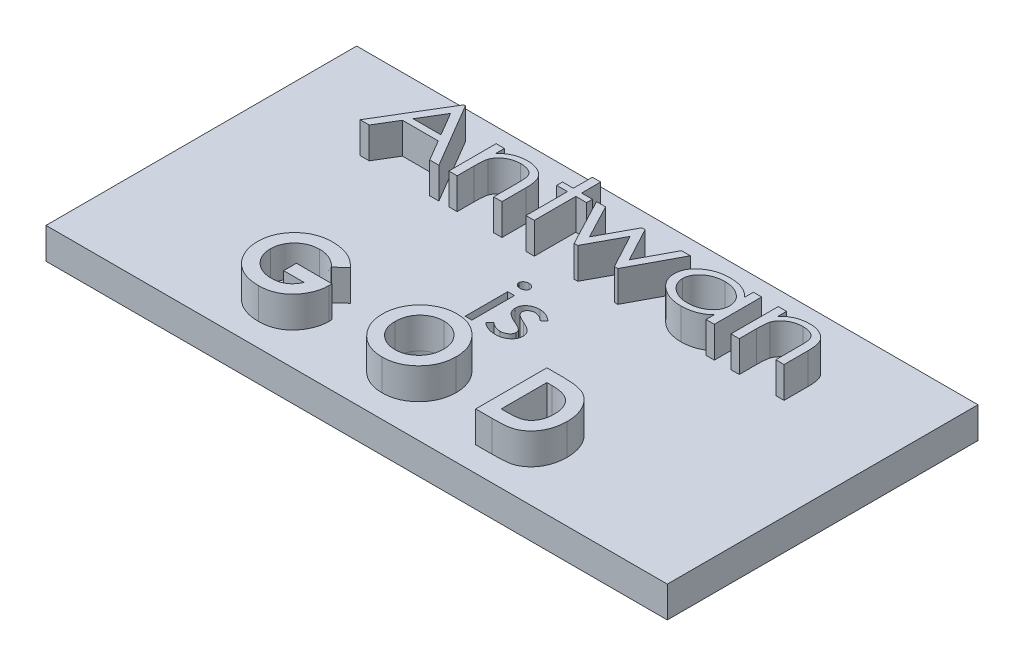
from build123d import *

# Parameters (mm, degrees)
SKETCH1_W           = 50.8
SKETCH1_H           = 25.4
BOSS_EXTRUDE1_DEPTH = 2.54
BOSS_EXTRUDE2_DEPTH = 2.54
SKETCH3_W           = 0.549519231
SKETCH3_H           = 3.480288462
CUT_EXTRUDE1_DEPTH  = 5.08
BOSS_EXTRUDE3_DEPTH = 2.54
SKETCH5_R           = 2.0033937
CUT_EXTRUDE2_DEPTH  = 5.08


with BuildPart() as part:
    # Sketch1 → Boss-Extrude1 (new body)
    with BuildSketch(Plane(origin=(0, 0, 0), x_dir=(1, 0, 0), z_dir=(0, 1, 0))):
        Rectangle(SKETCH1_W, SKETCH1_H)
    extrude(amount=BOSS_EXTRUDE1_DEPTH)

    # Sketch2 → Boss-Extrude2 (add)
    # profile 1 of 6: a face of its own
    with BuildSketch(Plane(origin=(0, 2.54, 0), x_dir=(1, 0, 0), z_dir=(0, 1, 0))):
        Polygon((-14.178952991, 10.371666667), (-11.058226496, 5.08), (-11.805547209, 5.08), (-12.806214944, 6.776047009), (-15.729775975, 6.776047009), (-16.752704327, 5.08), (-17.503205128, 5.08), (-14.314636752, 10.371666667), align=None)
        Polygon((-14.252095019, 9.228954995), (-15.403286926, 7.318782051), (-13.125283787, 7.318782051), align=None, mode=Mode.SUBTRACT)
    # profile 2 of 6: a face of its own
    with BuildSketch(Plane(origin=(0, 2.54, 0), x_dir=(1, 0, 0), z_dir=(0, 1, 0))):
        with BuildLine():
            Line((-10.244123932, 8.946987179), (-9.565705128, 8.946987179))
            Line((-9.565705128, 8.946987179), (-9.565705128, 8.249487847))
            add(Edge.make_bspline(
                [(-9.565705128, 8.249487847), (-9.501971138, 8.313083765), (-9.376701349, 8.438082172), (-9.169983485, 8.598427577), (-8.953033678, 8.731253425), (-8.725656088, 8.837011734), (-8.487670422, 8.915960139), (-8.24045632, 8.973670182), (-7.982638312, 9.008096925), (-7.807220218, 9.012560633), (-7.718073918, 9.01482906)],
                knots=[0, 0, 0, 0, 1.048340829, 2.060524298, 3.039920579, 4.006993634, 4.975678011, 5.956414776, 6.961463682, 8, 8, 8, 8], degree=3))
            add(Edge.make_bspline(
                [(-7.718073918, 9.01482906), (-7.67282343, 9.014323085), (-7.583254002, 9.013321551), (-7.450941232, 9.002188805), (-7.322167124, 8.985273817), (-7.197071809, 8.962329247), (-7.075938924, 8.931576775), (-6.959240298, 8.893229385), (-6.846425678, 8.848411678), (-6.737429989, 8.798046823), (-6.634331702, 8.740869359), (-6.537113919, 8.67966806), (-6.448145538, 8.612210908), (-6.364737159, 8.541613883), (-6.289712517, 8.464606466), (-6.220072833, 8.38420686), (-6.158812519, 8.298057232), (-6.10365039, 8.206571105), (-6.05485263, 8.106156412), (-6.014390093, 7.993675668), (-5.979206719, 7.868657229), (-5.951126379, 7.730790398), (-5.929073327, 7.580022183), (-5.913470267, 7.416222472), (-5.903934962, 7.23974738), (-5.902818998, 7.117742383), (-5.90224359, 7.054834736)],
                knots=[0, 0, 0, 0, 1.060262331, 2.098697624, 3.109423819, 4.103422854, 5.077526308, 6.035981208, 6.980163365, 7.921180839, 8.847767998, 9.741390013, 10.610897672, 11.462394881, 12.299761744, 13.127905681, 13.952896984, 14.773763409, 15.629317973, 16.56463403, 17.571315197, 18.670822078, 19.85951704, 21.14083011, 22.525768156, 24, 24, 24, 24], degree=3))
            Line((-5.90224359, 7.054834736), (-5.90224359, 5.08))
            Line((-5.90224359, 5.08), (-6.580662393, 5.08))
            Line((-6.580662393, 5.08), (-6.580662393, 6.899010417))
            add(Edge.make_bspline(
                [(-6.580662393, 6.899010417), (-6.581052408, 6.951658394), (-6.581798411, 7.052361118), (-6.582290197, 7.196539202), (-6.585207044, 7.327317526), (-6.591207305, 7.444217587), (-6.595529322, 7.547512114), (-6.603399569, 7.636875869), (-6.611105506, 7.712635908), (-6.618633966, 7.758366705), (-6.622003539, 7.778834802)],
                knots=[0, 0, 0, 0, 1.433218425, 2.741396849, 3.924848674, 4.993606899, 5.927859401, 6.738630715, 7.435438905, 8, 8, 8, 8], degree=3))
            add(Edge.make_bspline(
                [(-6.622003539, 7.778834802), (-6.628019017, 7.809748553), (-6.639802123, 7.870302348), (-6.668975964, 7.956513001), (-6.705644657, 8.036835502), (-6.748191922, 8.112480901), (-6.801391055, 8.180593399), (-6.860626137, 8.243560866), (-6.928392267, 8.300195949), (-7.003446404, 8.350792709), (-7.08572957, 8.395186349), (-7.173786927, 8.434661962), (-7.268219934, 8.467283022), (-7.368598073, 8.49359371), (-7.474716811, 8.515001335), (-7.586997924, 8.529537984), (-7.705223939, 8.537948875), (-7.785901967, 8.539262528), (-7.827256944, 8.539935897)],
                knots=[0, 0, 0, 0, 0.965271947, 1.890772867, 2.783379199, 3.672093861, 4.545808322, 5.427554647, 6.319963507, 7.248949126, 8.199687355, 9.184719788, 10.206290599, 11.260632854, 12.366059072, 13.525034421, 14.731350444, 16, 16, 16, 16], degree=3))
            add(Edge.make_bspline(
                [(-7.827256944, 8.539935897), (-7.874989088, 8.539200508), (-7.969597881, 8.537742909), (-8.109567787, 8.523710755), (-8.245417626, 8.500059621), (-8.377989315, 8.468937145), (-8.505838015, 8.425283186), (-8.63182519, 8.37660497), (-8.752369334, 8.315285207), (-8.868742413, 8.246937886), (-8.977516679, 8.171356363), (-9.078356627, 8.091273488), (-9.169540268, 8.006970836), (-9.250386929, 7.917300545), (-9.322069623, 7.824150024), (-9.382540115, 7.725333937), (-9.435217227, 7.623327262), (-9.461488382, 7.551592664), (-9.474542601, 7.515947516)],
                knots=[0, 0, 0, 0, 1.109799123, 2.199707542, 3.266922372, 4.315242432, 5.362434729, 6.406139389, 7.453460635, 8.503357528, 9.542751149, 10.53089283, 11.496046904, 12.426870173, 13.335708312, 14.22502026, 15.118006989, 16, 16, 16, 16], degree=3))
            add(Edge.make_bspline(
                [(-9.474542601, 7.515947516), (-9.48192069, 7.489879513), (-9.497944194, 7.433265829), (-9.516680919, 7.340165441), (-9.530805388, 7.232073697), (-9.5433023, 7.109751603), (-9.554045896, 6.972638103), (-9.561145289, 6.820986618), (-9.565405996, 6.654522252), (-9.56560263, 6.538603246), (-9.565705128, 6.478178753)],
                knots=[0, 0, 0, 0, 0.622153576, 1.351173928, 2.178755345, 3.125267428, 4.175407924, 5.337424846, 6.612093389, 8, 8, 8, 8], degree=3))
            Line((-9.565705128, 6.478178753), (-9.565705128, 5.08))
            Line((-9.565705128, 5.08), (-10.244123932, 5.08))
            Line((-10.244123932, 5.08), (-10.244123932, 8.946987179))
        make_face()
    # profile 3 of 6: a face of its own
    with BuildSketch(Plane(origin=(0, 2.54, 0), x_dir=(1, 0, 0), z_dir=(0, 1, 0))):
        Polygon((-3.93482906, 10.507350427), (-3.256410256, 10.507350427), (-3.256410256, 8.946987179), (-2.374465812, 8.946987179), (-2.374465812, 8.472094017), (-3.256410256, 8.472094017), (-3.256410256, 5.08), (-3.93482906, 5.08), (-3.93482906, 8.472094017), (-4.816773504, 8.472094017), (-4.816773504, 8.946987179), (-3.93482906, 8.946987179), align=None)
    # profile 4 of 6: a face of its own
    with BuildSketch(Plane(origin=(0, 2.54, 0), x_dir=(1, 0, 0), z_dir=(0, 1, 0))):
        Polygon((-2.03525641, 8.946987179), (-1.296415932, 8.946987179), (0.169604701, 6.165470085), (1.668486245, 8.946987179), (1.93349359, 8.946987179), (3.426014957, 6.165470085), (4.907936031, 8.946987179), (5.630876068, 8.946987179), (3.569118924, 5.08), (3.290331197, 5.08), (1.797809829, 7.861517094), (0.297868256, 5.08), (0.003180088, 5.08), align=None)
    # profile 5 of 6: a face of its own
    with BuildSketch(Plane(origin=(0, 2.54, 0), x_dir=(1, 0, 0), z_dir=(0, 1, 0))):
        with BuildLine():
            Line((11.465277778, 8.946987179), (11.465277778, 5.08))
            Line((11.465277778, 5.08), (10.786858974, 5.08))
            Line((10.786858974, 5.08), (10.786858974, 5.748878539))
            add(Edge.make_bspline(
                [(10.786858974, 5.748878539), (10.719211003, 5.687974022), (10.585289143, 5.567402097), (10.363765824, 5.414770407), (10.130826099, 5.286717801), (9.885421069, 5.184624725), (9.628081731, 5.107135135), (9.359375303, 5.05301268), (9.079049472, 5.017310391), (8.888105858, 5.013897118), (8.790823651, 5.01215812)],
                knots=[0, 0, 0, 0, 1.000186988, 1.98005792, 2.950451851, 3.918937695, 4.897459287, 5.901142758, 6.930671412, 8, 8, 8, 8], degree=3))
            add(Edge.make_bspline(
                [(8.790823651, 5.01215812), (8.704534502, 5.014022909), (8.534337454, 5.017701026), (8.284104676, 5.045820271), (8.043419163, 5.091266606), (7.812301613, 5.154652209), (7.591145063, 5.237824971), (7.379393662, 5.338846698), (7.176919854, 5.457962227), (6.987115799, 5.594648275), (6.813272326, 5.743584664), (6.660186738, 5.902020762), (6.530768134, 6.069262872), (6.425123433, 6.24504076), (6.342630191, 6.428630144), (6.284071225, 6.620154433), (6.247958338, 6.819557774), (6.243638016, 6.955394021), (6.241452991, 7.024093884)],
                knots=[0, 0, 0, 0, 1.149825968, 2.267921147, 3.351292848, 4.411532189, 5.457652975, 6.496092779, 7.534724766, 8.584157928, 9.609304174, 10.581842155, 11.515285724, 12.421436469, 13.308880013, 14.190720771, 15.08494796, 16, 16, 16, 16], degree=3))
            add(Edge.make_bspline(
                [(6.241452991, 7.024093884), (6.243683906, 7.091372628), (6.248106088, 7.224734437), (6.283767914, 7.420866391), (6.344080843, 7.609295978), (6.426991174, 7.790343042), (6.534317736, 7.963328737), (6.665180838, 8.12826682), (6.818272535, 8.287023633), (6.99460448, 8.434072198), (7.185815511, 8.570444589), (7.389859042, 8.688829654), (7.602543813, 8.790617555), (7.825768778, 8.871924675), (8.057744275, 8.936957917), (8.299965183, 8.982483702), (8.551370323, 9.008943824), (8.722212665, 9.012848871), (8.808844151, 9.01482906)],
                knots=[0, 0, 0, 0, 0.897261844, 1.778577538, 2.649325713, 3.531133061, 4.428679736, 5.358639195, 6.335549813, 7.365975323, 8.417697389, 9.465640286, 10.50951357, 11.559596491, 12.631383867, 13.72061521, 14.844159534, 16, 16, 16, 16], degree=3))
            add(Edge.make_bspline(
                [(8.808844151, 9.01482906), (8.908585517, 9.012659388), (9.103759874, 9.008413765), (9.38919363, 8.973153473), (9.659691826, 8.913340005), (9.874826106, 8.845462921), (10.039057278, 8.778609573), (10.15779165, 8.721498197), (10.27225735, 8.65662951), (10.382780035, 8.585151073), (10.490265882, 8.508079332), (10.593181309, 8.422579588), (10.692915266, 8.330842868), (10.755436284, 8.264706893), (10.786858974, 8.231467348)],
                knots=[0, 0, 0, 0, 1.636409053, 3.202132658, 4.710311817, 6.177333486, 6.897697258, 7.618667534, 8.337886887, 9.05523388, 9.777834522, 10.506897114, 11.24957541, 12, 12, 12, 12], degree=3))
            Line((10.786858974, 8.231467348), (10.786858974, 8.946987179))
            Line((10.786858974, 8.946987179), (11.465277778, 8.946987179))
        make_face()
        with BuildLine():
            add(Edge.make_bspline(
                [(8.855485443, 8.539935897), (8.769843397, 8.537469194), (8.600921553, 8.532603825), (8.352429492, 8.494650061), (8.114007769, 8.432058329), (7.887839889, 8.345536724), (7.677450196, 8.237296277), (7.48873982, 8.105882711), (7.32107388, 7.955356721), (7.201691574, 7.812873732), (7.12000029, 7.69169862), (7.066492207, 7.599655402), (7.020157239, 7.506651321), (6.984904613, 7.410995798), (6.95574604, 7.314814181), (6.934100072, 7.217486314), (6.922660676, 7.118359312), (6.920802863, 7.052033701), (6.919871795, 7.018793737)],
                knots=[0, 0, 0, 0, 1.507851667, 2.974112515, 4.41564081, 5.841814224, 7.23074732, 8.57209151, 9.880684575, 11.188226603, 11.833756132, 12.452826221, 13.062345153, 13.661062237, 14.245806186, 14.831708012, 15.414494903, 16, 16, 16, 16], degree=3))
            add(Edge.make_bspline(
                [(6.919871795, 7.018793737), (6.92068002, 6.985890221), (6.922302418, 6.919841055), (6.935686678, 6.821703324), (6.95577955, 6.724169443), (6.984221853, 6.627949624), (7.022088374, 6.532862095), (7.067173804, 6.438615678), (7.122377167, 6.346263992), (7.20336491, 6.22311007), (7.324815933, 6.080289526), (7.492500561, 5.927316068), (7.683040759, 5.795143852), (7.893841179, 5.684957323), (8.119310081, 5.595787038), (8.356455169, 5.533972931), (8.601143654, 5.494092787), (8.767347398, 5.489413392), (8.851245326, 5.487051282)],
                knots=[0, 0, 0, 0, 0.57949018, 1.163244804, 1.741965386, 2.332879268, 2.928236174, 3.543567576, 4.171368968, 4.822294746, 6.139064333, 7.461091678, 8.81157044, 10.212281651, 11.64345589, 13.073451711, 14.522708737, 16, 16, 16, 16], degree=3))
            add(Edge.make_bspline(
                [(8.851245326, 5.487051282), (8.93618116, 5.489532951), (9.104396624, 5.494447896), (9.353168, 5.532674469), (9.595051184, 5.595438606), (9.790034976, 5.66835625), (9.938762223, 5.738784021), (10.044894592, 5.795162219), (10.144117122, 5.856296875), (10.236602933, 5.92208723), (10.32220143, 5.992360895), (10.400114483, 6.067827383), (10.473162535, 6.146439041), (10.538435244, 6.229971184), (10.596922416, 6.317098113), (10.648238579, 6.407177309), (10.690353529, 6.50078935), (10.725443468, 6.596425001), (10.753587586, 6.694423366), (10.772187388, 6.795629835), (10.784250001, 6.899427126), (10.785985054, 6.969645422), (10.786858974, 7.005013355)],
                knots=[0, 0, 0, 0, 1.862528734, 3.688739127, 5.506640726, 7.336400479, 8.244805844, 9.115182216, 9.971292008, 10.799328464, 11.603178334, 12.3980472, 13.176998374, 13.955370903, 14.720667152, 15.477279131, 16.22651052, 16.969501729, 17.710509303, 18.459941124, 19.224294792, 20, 20, 20, 20], degree=3))
            add(Edge.make_bspline(
                [(10.786858974, 7.005013355), (10.785388784, 7.05849017), (10.782487998, 7.164003581), (10.754639341, 7.31865194), (10.711802508, 7.467057593), (10.649217011, 7.608028498), (10.570152182, 7.742348585), (10.474276107, 7.870434101), (10.359484212, 7.990628151), (10.229109344, 8.10256867), (10.086424461, 8.204892554), (9.934803453, 8.295700754), (9.773970574, 8.370822999), (9.605672806, 8.432084748), (9.429835519, 8.48198643), (9.24509041, 8.514410927), (9.052860246, 8.537076023), (8.921983414, 8.538972371), (8.855485443, 8.539935897)],
                knots=[0, 0, 0, 0, 0.934434866, 1.843703859, 2.739261944, 3.630245698, 4.533235222, 5.460181769, 6.421866164, 7.43398917, 8.461260833, 9.48927571, 10.520406241, 11.560497361, 12.619021795, 13.71231236, 14.837635478, 16, 16, 16, 16], degree=3))
        make_face(mode=Mode.SUBTRACT)
    # profile 6 of 6: a face of its own
    with BuildSketch(Plane(origin=(0, 2.54, 0), x_dir=(1, 0, 0), z_dir=(0, 1, 0))):
        with BuildLine():
            Line((12.822115385, 8.946987179), (13.500534188, 8.946987179))
            Line((13.500534188, 8.946987179), (13.500534188, 8.249487847))
            add(Edge.make_bspline(
                [(13.500534188, 8.249487847), (13.564268178, 8.313083765), (13.689537967, 8.438082172), (13.896255832, 8.598427577), (14.113205639, 8.731253425), (14.340583228, 8.837011734), (14.578568894, 8.915960139), (14.825782996, 8.973670182), (15.083601004, 9.008096925), (15.259019098, 9.012560633), (15.348165398, 9.01482906)],
                knots=[0, 0, 0, 0, 1.048340829, 2.060524298, 3.039920579, 4.006993634, 4.975678011, 5.956414776, 6.961463682, 8, 8, 8, 8], degree=3))
            add(Edge.make_bspline(
                [(15.348165398, 9.01482906), (15.393415886, 9.014323085), (15.482985314, 9.013321551), (15.615298084, 9.002188805), (15.744072193, 8.985273817), (15.869167507, 8.962329247), (15.990300392, 8.931576775), (16.106999018, 8.893229385), (16.219813638, 8.848411678), (16.328809328, 8.798046823), (16.431907614, 8.740869359), (16.529125397, 8.67966806), (16.618093779, 8.612210908), (16.701502158, 8.541613883), (16.7765268, 8.464606466), (16.846166483, 8.38420686), (16.907426797, 8.298057232), (16.962588926, 8.206571105), (17.011386686, 8.106156412), (17.051849223, 7.993675668), (17.087032598, 7.868657229), (17.115112937, 7.730790398), (17.137165989, 7.580022183), (17.152769049, 7.416222472), (17.162304354, 7.23974738), (17.163420318, 7.117742383), (17.163995726, 7.054834736)],
                knots=[0, 0, 0, 0, 1.060262331, 2.098697624, 3.109423819, 4.103422854, 5.077526308, 6.035981208, 6.980163365, 7.921180839, 8.847767998, 9.741390013, 10.610897672, 11.462394881, 12.299761744, 13.127905681, 13.952896984, 14.773763409, 15.629317973, 16.56463403, 17.571315197, 18.670822078, 19.85951704, 21.14083011, 22.525768156, 24, 24, 24, 24], degree=3))
            Line((17.163995726, 7.054834736), (17.163995726, 5.08))
            Line((17.163995726, 5.08), (16.485576923, 5.08))
            Line((16.485576923, 5.08), (16.485576923, 6.899010417))
            add(Edge.make_bspline(
                [(16.485576923, 6.899010417), (16.485186908, 6.951658394), (16.484440906, 7.052361118), (16.483949119, 7.196539202), (16.481032272, 7.327317526), (16.475032011, 7.444217587), (16.470709994, 7.547512114), (16.462839747, 7.636875869), (16.45513381, 7.712635908), (16.44760535, 7.758366705), (16.444235777, 7.778834802)],
                knots=[0, 0, 0, 0, 1.433218425, 2.741396849, 3.924848674, 4.993606899, 5.927859401, 6.738630715, 7.435438905, 8, 8, 8, 8], degree=3))
            add(Edge.make_bspline(
                [(16.444235777, 7.778834802), (16.4382203, 7.809748553), (16.426437193, 7.870302348), (16.397263353, 7.956513001), (16.360594659, 8.036835502), (16.318047394, 8.112480901), (16.264848261, 8.180593399), (16.20561318, 8.243560866), (16.137847049, 8.300195949), (16.062792913, 8.350792709), (15.980509746, 8.395186349), (15.89245239, 8.434661962), (15.798019382, 8.467283022), (15.697641243, 8.49359371), (15.591522506, 8.515001335), (15.479241392, 8.529537984), (15.361015377, 8.537948875), (15.280337349, 8.539262528), (15.238982372, 8.539935897)],
                knots=[0, 0, 0, 0, 0.965271947, 1.890772867, 2.783379199, 3.672093861, 4.545808322, 5.427554647, 6.319963507, 7.248949126, 8.199687355, 9.184719788, 10.206290599, 11.260632854, 12.366059072, 13.525034421, 14.731350444, 16, 16, 16, 16], degree=3))
            add(Edge.make_bspline(
                [(15.238982372, 8.539935897), (15.191250229, 8.539200508), (15.096641436, 8.537742909), (14.956671529, 8.523710755), (14.820821691, 8.500059621), (14.688250001, 8.468937145), (14.560401301, 8.425283186), (14.434414126, 8.37660497), (14.313869983, 8.315285207), (14.197496903, 8.246937886), (14.088722637, 8.171356363), (13.987882689, 8.091273488), (13.896699048, 8.006970836), (13.815852387, 7.917300545), (13.744169693, 7.824150024), (13.683699202, 7.725333937), (13.63102209, 7.623327262), (13.604750934, 7.551592664), (13.591696715, 7.515947516)],
                knots=[0, 0, 0, 0, 1.109799123, 2.199707542, 3.266922372, 4.315242432, 5.362434729, 6.406139389, 7.453460635, 8.503357528, 9.542751149, 10.53089283, 11.496046904, 12.426870173, 13.335708312, 14.22502026, 15.118006989, 16, 16, 16, 16], degree=3))
            add(Edge.make_bspline(
                [(13.591696715, 7.515947516), (13.584318627, 7.489879513), (13.568295123, 7.433265829), (13.549558398, 7.340165441), (13.535433928, 7.232073697), (13.522937016, 7.109751603), (13.51219342, 6.972638103), (13.505094027, 6.820986618), (13.50083332, 6.654522252), (13.500636686, 6.538603246), (13.500534188, 6.478178753)],
                knots=[0, 0, 0, 0, 0.622153576, 1.351173928, 2.178755345, 3.125267428, 4.175407924, 5.337424846, 6.612093389, 8, 8, 8, 8], degree=3))
            Line((13.500534188, 6.478178753), (13.500534188, 5.08))
            Line((13.500534188, 5.08), (12.822115385, 5.08))
            Line((12.822115385, 5.08), (12.822115385, 8.946987179))
        make_face()
    extrude(amount=BOSS_EXTRUDE2_DEPTH)

    # Sketch3 → Cut-Extrude1 (cut)
    with BuildSketch(Plane(origin=(0, 2.54, 0), x_dir=(1, 0, 0), z_dir=(0, 1, 0))):
        with BuildLine():
            add(Edge.make_bspline(
                [(-1.558879207, 2.94754881), (-1.528247703, 2.946310031), (-1.468515684, 2.943894387), (-1.382299681, 2.923756607), (-1.303979801, 2.888439832), (-1.233871058, 2.842234311), (-1.174442973, 2.786684937), (-1.130346868, 2.723213155), (-1.103985364, 2.6527884), (-1.100701107, 2.603995749), (-1.099038462, 2.579294604)],
                knots=[0, 0, 0, 0, 1.126292746, 2.196292449, 3.23347918, 4.271985151, 5.273442343, 6.208143861, 7.092877767, 8, 8, 8, 8], degree=3))
            add(Edge.make_bspline(
                [(-1.099038462, 2.579294604), (-1.100736009, 2.555234216), (-1.104111656, 2.507389105), (-1.13034945, 2.438160173), (-1.174770892, 2.375640395), (-1.233832074, 2.320142144), (-1.303990376, 2.273973309), (-1.382296768, 2.23864655), (-1.468516467, 2.218511506), (-1.528247969, 2.216095479), (-1.558879207, 2.214856503)],
                knots=[0, 0, 0, 0, 0.888755228, 1.767327854, 2.697484928, 3.7044632, 4.748694502, 5.79159929, 6.86749795, 8, 8, 8, 8], degree=3))
            add(Edge.make_bspline(
                [(-1.558879207, 2.214856503), (-1.58887797, 2.216105702), (-1.647669539, 2.218553882), (-1.732864778, 2.238833518), (-1.810930524, 2.273943983), (-1.880985059, 2.320199891), (-1.940264998, 2.375329123), (-1.983448297, 2.438474905), (-2.009882557, 2.50735334), (-2.013223667, 2.555222249), (-2.014903846, 2.579294604)],
                knots=[0, 0, 0, 0, 1.114826149, 2.184835993, 3.233187219, 4.282871886, 5.295108974, 6.223442501, 7.10660336, 8, 8, 8, 8], degree=3))
            add(Edge.make_bspline(
                [(-2.014903846, 2.579294604), (-2.013259193, 2.604007957), (-2.010010478, 2.652824724), (-1.983446457, 2.722900197), (-1.940593644, 2.786991753), (-1.880946479, 2.842177625), (-1.810940993, 2.888468873), (-1.732861927, 2.923569742), (-1.647670293, 2.943851974), (-1.588878225, 2.946299795), (-1.558879207, 2.94754881)],
                knots=[0, 0, 0, 0, 0.911825585, 1.801146763, 2.734119375, 3.740769039, 4.784659576, 5.827224033, 6.891327554, 8, 8, 8, 8], degree=3))
        make_face()
        with Locations((-1.556971154, -0.257980036)):
            Rectangle(SKETCH3_W, SKETCH3_H)
        with BuildLine():
            Line((1.892788462, 1.048082164), (1.549338942, 0.749471887))
            add(Edge.make_bspline(
                [(1.549338942, 0.749471887), (1.516684572, 0.778595656), (1.453164936, 0.835247528), (1.353677107, 0.909483407), (1.255338997, 0.972943899), (1.157555404, 1.025133276), (1.060076125, 1.065424997), (0.962963574, 1.094417507), (0.866287974, 1.112395087), (0.801773123, 1.114686139), (0.769899339, 1.115818041)],
                knots=[0, 0, 0, 0, 1.191143459, 2.317025185, 3.376493024, 4.376036135, 5.331378458, 6.243873407, 7.132379622, 8, 8, 8, 8], degree=3))
            add(Edge.make_bspline(
                [(0.769899339, 1.115818041), (0.73092821, 1.114364615), (0.654870025, 1.11152803), (0.54552064, 1.083576895), (0.444389604, 1.039526722), (0.355173273, 0.9778304), (0.280331838, 0.905722286), (0.22354251, 0.826177924), (0.188914833, 0.738792173), (0.18508941, 0.677896526), (0.183173077, 0.647391058)],
                knots=[0, 0, 0, 0, 1.126613547, 2.19876053, 3.246056558, 4.306150977, 5.322123348, 6.241830403, 7.119250902, 8, 8, 8, 8], degree=3))
            add(Edge.make_bspline(
                [(0.183173077, 0.647391058), (0.185070095, 0.619799434), (0.188893514, 0.564188835), (0.219005785, 0.482715753), (0.266384032, 0.403560759), (0.309450811, 0.356335918), (0.332001202, 0.331608306)],
                knots=[0, 0, 0, 0, 0.923464895, 1.861232764, 2.88011042, 4, 4, 4, 4], degree=3))
            add(Edge.make_bspline(
                [(0.332001202, 0.331608306), (0.346071142, 0.318285844), (0.376135261, 0.28981891), (0.429977778, 0.250151649), (0.49243284, 0.206935503), (0.566374459, 0.163845462), (0.649274953, 0.117494056), (0.743507563, 0.071457914), (0.846962268, 0.021292315), (0.920505146, -0.010534454), (0.958796575, -0.027105637)],
                knots=[0, 0, 0, 0, 0.640357809, 1.368292506, 2.208553831, 3.152034543, 4.197222919, 5.349749855, 6.620099349, 8, 8, 8, 8], degree=3))
            add(Edge.make_bspline(
                [(0.958796575, -0.027105637), (1.005333604, -0.047856128), (1.09512793, -0.087894704), (1.22333098, -0.149684271), (1.33955385, -0.211865215), (1.444926632, -0.272230661), (1.537567527, -0.333630955), (1.619255859, -0.393533117), (1.689421723, -0.453250036), (1.729651786, -0.49552074), (1.748730469, -0.515567175)],
                knots=[0, 0, 0, 0, 1.307861289, 2.523550029, 3.651918164, 4.690727197, 5.639318476, 6.502942042, 7.290036046, 8, 8, 8, 8], degree=3))
            add(Edge.make_bspline(
                [(1.748730469, -0.515567175), (1.780251111, -0.555545069), (1.841888435, -0.633720201), (1.905594389, -0.767415756), (1.947529445, -0.907674495), (1.951727401, -1.004678933), (1.953846154, -1.053638089)],
                knots=[0, 0, 0, 0, 1.035861265, 2.025584197, 3.003491674, 4, 4, 4, 4], degree=3))
            add(Edge.make_bspline(
                [(1.953846154, -1.053638089), (1.952811777, -1.088067608), (1.950768081, -1.156092591), (1.932512196, -1.255786226), (1.905764981, -1.352114963), (1.864131316, -1.443227483), (1.814222783, -1.531883487), (1.750009711, -1.614687988), (1.676222153, -1.694493544), (1.591750692, -1.769128421), (1.499135115, -1.837088686), (1.400140075, -1.897171004), (1.29485448, -1.946206073), (1.184284494, -1.987779483), (1.068088665, -2.020027947), (0.945878936, -2.043025299), (0.818212659, -2.056263888), (0.731132492, -2.058198997), (0.686899038, -2.059181959)],
                knots=[0, 0, 0, 0, 0.917983003, 1.813727822, 2.697369886, 3.578890162, 4.479966245, 5.406733975, 6.367575675, 7.377535281, 8.409575044, 9.429858185, 10.462456109, 11.504427907, 12.579268083, 13.676162811, 14.819577984, 16, 16, 16, 16], degree=3))
            add(Edge.make_bspline(
                [(0.686899038, -2.059181959), (0.627028679, -2.057836243), (0.508392135, -2.05516963), (0.332817189, -2.030121311), (0.161368337, -1.991097561), (-0.00452181, -1.937218946), (-0.161416185, -1.869345552), (-0.305097238, -1.787424269), (-0.436425753, -1.695975664), (-0.512199993, -1.623558671), (-0.549519231, -1.587892896)],
                knots=[0, 0, 0, 0, 1.058510203, 2.097498541, 3.130500184, 4.165827308, 5.17851881, 6.1483704, 7.088062041, 8, 8, 8, 8], degree=3))
            Line((-0.549519231, -1.587892896), (-0.213701923, -1.265431959))
            add(Edge.make_bspline(
                [(-0.213701923, -1.265431959), (-0.180113156, -1.294596809), (-0.114520225, -1.351550612), (-0.010963302, -1.425955), (0.093554656, -1.48999947), (0.20046457, -1.541321499), (0.308668599, -1.581836561), (0.418262254, -1.610634035), (0.529530952, -1.628511697), (0.604469137, -1.630686955), (0.642059796, -1.631778113)],
                knots=[0, 0, 0, 0, 1.119911591, 2.186989617, 3.207633793, 4.203557822, 5.169161927, 6.113367086, 7.053623003, 8, 8, 8, 8], degree=3))
            add(Edge.make_bspline(
                [(0.642059796, -1.631778113), (0.693124209, -1.629916869), (0.792469177, -1.62629585), (0.935063185, -1.593740225), (1.066576085, -1.542305122), (1.164347692, -1.480425975), (1.233834913, -1.423695616), (1.279728368, -1.379440308), (1.317849487, -1.332498322), (1.349604008, -1.284071282), (1.373816383, -1.233647894), (1.391238874, -1.181445226), (1.401897869, -1.127208623), (1.403516839, -1.090255059), (1.404326923, -1.071764591)],
                knots=[0, 0, 0, 0, 1.758912634, 3.42193528, 5.016576944, 6.608085231, 7.387459445, 8.108722022, 8.802442668, 9.468656318, 10.10144287, 10.725713422, 11.362384753, 12, 12, 12, 12], degree=3))
            add(Edge.make_bspline(
                [(1.404326923, -1.071764591), (1.402470422, -1.041327544), (1.398776234, -0.980761885), (1.369476903, -0.893424476), (1.322968656, -0.810885778), (1.279168735, -0.764052491), (1.256452825, -0.739763389)],
                knots=[0, 0, 0, 0, 0.977076222, 1.944251207, 2.933828981, 4, 4, 4, 4], degree=3))
            add(Edge.make_bspline(
                [(1.256452825, -0.739763389), (1.242304743, -0.727478435), (1.211484814, -0.700717111), (1.157222485, -0.661564319), (1.091535865, -0.619980741), (1.0138716, -0.57600117), (0.92442239, -0.530863408), (0.823561466, -0.48288513), (0.711158619, -0.432584701), (0.631936292, -0.398735674), (0.590542368, -0.381049447)],
                knots=[0, 0, 0, 0, 0.59191485, 1.289416773, 2.111843539, 3.047985872, 4.108703244, 5.277464275, 6.577466189, 8, 8, 8, 8], degree=3))
            add(Edge.make_bspline(
                [(0.590542368, -0.381049447), (0.545870814, -0.361341553), (0.459687162, -0.323319633), (0.337268904, -0.26295514), (0.225932888, -0.203067829), (0.125233412, -0.144235515), (0.036122189, -0.084861495), (-0.042294091, -0.026061721), (-0.109653635, 0.032674699), (-0.147887999, 0.074324933), (-0.166000601, 0.094055721)],
                knots=[0, 0, 0, 0, 1.302050987, 2.512012704, 3.639023741, 4.673208883, 5.621170565, 6.493044743, 7.286116506, 8, 8, 8, 8], degree=3))
            add(Edge.make_bspline(
                [(-0.166000601, 0.094055721), (-0.196979948, 0.13336118), (-0.257914602, 0.210672833), (-0.318693276, 0.344080118), (-0.360074608, 0.48399576), (-0.364232409, 0.580936031), (-0.366346154, 0.630218582)],
                knots=[0, 0, 0, 0, 1.024208753, 2.014561685, 2.990641718, 4, 4, 4, 4], degree=3))
            add(Edge.make_bspline(
                [(-0.366346154, 0.630218582), (-0.365561633, 0.662405034), (-0.364022068, 0.725568606), (-0.347950848, 0.818004972), (-0.323145611, 0.906287711), (-0.288997305, 0.990894609), (-0.243280181, 1.070469923), (-0.188607087, 1.146531109), (-0.123452288, 1.218016808), (-0.048962491, 1.284340899), (0.032344853, 1.345388789), (0.120677626, 1.39762438), (0.21375875, 1.442882333), (0.312055626, 1.480068551), (0.415525107, 1.508792417), (0.52412259, 1.528425663), (0.637926748, 1.541433451), (0.715800212, 1.542617109), (0.755588942, 1.543221887)],
                knots=[0, 0, 0, 0, 0.956207867, 1.876488459, 2.780496963, 3.679546525, 4.581475594, 5.502630193, 6.459912792, 7.450926542, 8.464598021, 9.478137181, 10.497350532, 11.538779896, 12.598676211, 13.685479207, 14.817416878, 16, 16, 16, 16], degree=3))
            add(Edge.make_bspline(
                [(0.755588942, 1.543221887), (0.802736429, 1.541697226), (0.897891688, 1.538620084), (1.040378972, 1.515110636), (1.182649691, 1.475161665), (1.325114541, 1.420588734), (1.46781302, 1.35010006), (1.610819661, 1.265139653), (1.75402243, 1.164292675), (1.845633225, 1.087572622), (1.892788462, 1.048082164)],
                knots=[0, 0, 0, 0, 0.892727674, 1.80174466, 2.726744544, 3.687621175, 4.686992407, 5.737527298, 6.835427255, 8, 8, 8, 8], degree=3))
        make_face()
    extrude(amount=-CUT_EXTRUDE1_DEPTH, mode=Mode.SUBTRACT)

    # Sketch4 → Boss-Extrude3 (add)
    # profile 1 of 3: a face of its own
    with BuildSketch(Plane(origin=(0, 2.54, 0), x_dir=(1, 0, 0), z_dir=(0, 1, 0))):
        with BuildLine():
            Line((-7.441385049, -5.772996327), (-8.231954961, -6.529751302))
            add(Edge.make_bspline(
                [(-8.231954961, -6.529751302), (-8.294545761, -6.467085508), (-8.417359242, -6.344124874), (-8.618205329, -6.184083158), (-8.826220919, -6.048016061), (-9.042090676, -5.936132176), (-9.266115308, -5.849345308), (-9.497852718, -5.787263884), (-9.737679913, -5.750442339), (-9.900032219, -5.745287449), (-9.982169471, -5.742679487)],
                knots=[0, 0, 0, 0, 1.075575784, 2.110457258, 3.113929901, 4.09197124, 5.059417775, 6.02750972, 7.002078037, 8, 8, 8, 8], degree=3))
            add(Edge.make_bspline(
                [(-9.982169471, -5.742679487), (-10.053379958, -5.744506874), (-10.19320799, -5.748095108), (-10.398671817, -5.775343914), (-10.59500509, -5.820861818), (-10.783135367, -5.883919273), (-10.961914049, -5.965976953), (-11.132377012, -6.065768392), (-11.293475227, -6.184057005), (-11.443940159, -6.318600449), (-11.580938965, -6.465494726), (-11.700546156, -6.622723544), (-11.802425787, -6.787356293), (-11.886293502, -6.960235258), (-11.950107712, -7.141095103), (-11.995662708, -7.329804534), (-12.024578802, -7.525815135), (-12.027992929, -7.659535597), (-12.029722222, -7.727266493)],
                knots=[0, 0, 0, 0, 1.075001177, 2.110859044, 3.123021556, 4.114053297, 5.101481495, 6.087880186, 7.091499647, 8.114004866, 9.131394192, 10.11971144, 11.092043119, 12.050101265, 13.015322563, 13.981809771, 14.977764287, 16, 16, 16, 16], degree=3))
            add(Edge.make_bspline(
                [(-12.029722222, -7.727266493), (-12.02810922, -7.797341646), (-12.024931386, -7.93539929), (-11.994404692, -8.138004818), (-11.947373065, -8.332925936), (-11.878531303, -8.518716374), (-11.793807943, -8.697921201), (-11.686364763, -8.867069051), (-11.561075263, -9.028742995), (-11.418163319, -9.180128198), (-11.26271203, -9.319668922), (-11.094353225, -9.440040343), (-10.918209414, -9.543894896), (-10.731437625, -9.626144345), (-10.537279664, -9.692181642), (-10.333766213, -9.738743603), (-10.121355534, -9.767309205), (-9.976429643, -9.770744006), (-9.902879274, -9.772487179)],
                knots=[0, 0, 0, 0, 1.022067601, 2.013613092, 2.983553406, 3.943623673, 4.90013463, 5.87121881, 6.861774014, 7.881098904, 8.905697761, 9.905387765, 10.89678721, 11.884561068, 12.87834324, 13.885584958, 14.926927371, 16, 16, 16, 16], degree=3))
            add(Edge.make_bspline(
                [(-9.902879274, -9.772487179), (-9.855037482, -9.772055511), (-9.7611134, -9.771208051), (-9.623342778, -9.757451379), (-9.491391613, -9.737784619), (-9.364748895, -9.711748163), (-9.244693375, -9.674901906), (-9.129562803, -9.631814746), (-9.020031742, -9.580963306), (-8.916694059, -9.520593117), (-8.818011788, -9.452925513), (-8.724908616, -9.375499386), (-8.635751402, -9.290060408), (-8.551581937, -9.195564822), (-8.473824815, -9.091167726), (-8.399988894, -8.978787555), (-8.330919583, -8.857309004), (-8.29010835, -8.771527005), (-8.269267995, -8.727722222)],
                knots=[0, 0, 0, 0, 1.109579412, 2.178351274, 3.208885622, 4.204702371, 5.174744997, 6.119429583, 7.05542196, 7.97267548, 8.893247984, 9.828544973, 10.778894627, 11.756245826, 12.760884819, 13.796418446, 14.874735809, 16, 16, 16, 16], degree=3))
            Line((-8.269267995, -8.727722222), (-9.940192308, -8.727722222))
            Line((-9.940192308, -8.727722222), (-9.940192308, -7.682957265))
            Line((-9.940192308, -7.682957265), (-7.037937867, -7.682957265))
            Line((-7.037937867, -7.682957265), (-7.029775641, -7.931322149))
            add(Edge.make_bspline(
                [(-7.029775641, -7.931322149), (-7.030824426, -7.995108553), (-7.032920125, -8.122567528), (-7.052072616, -8.312332229), (-7.083798426, -8.499580095), (-7.127170644, -8.684123058), (-7.181527005, -8.866866368), (-7.250848381, -9.046060106), (-7.332023289, -9.222919505), (-7.422974014, -9.396693047), (-7.52517646, -9.563433487), (-7.6352124, -9.721314671), (-7.751513197, -9.870063344), (-7.876608345, -10.007607061), (-8.008549906, -10.135101253), (-8.147597609, -10.252055433), (-8.294243258, -10.358568559), (-8.447710014, -10.455540423), (-8.608872017, -10.540530541), (-8.776843198, -10.614460668), (-8.951369945, -10.677247964), (-9.132902843, -10.728719889), (-9.321084683, -10.768434573), (-9.515919494, -10.795666984), (-9.717514283, -10.814171714), (-9.854251764, -10.816212915), (-9.923867855, -10.817252137)],
                knots=[0, 0, 0, 0, 1.006889344, 2.011981806, 3.007738725, 4.003571281, 5.003404394, 6.015442001, 7.03424805, 8.074616296, 9.110249922, 10.119753985, 11.111721717, 12.089233633, 13.052717867, 14.006597561, 14.955430184, 15.912305663, 16.870361111, 17.829300583, 18.807640451, 19.796414044, 20.806216501, 21.841577364, 22.90109906, 24, 24, 24, 24], degree=3))
            add(Edge.make_bspline(
                [(-9.923867855, -10.817252137), (-9.998143504, -10.816225886), (-10.145379995, -10.814191552), (-10.363088879, -10.795138628), (-10.574481892, -10.763693006), (-10.779611763, -10.72017334), (-10.978954759, -10.66600964), (-11.17216838, -10.598021383), (-11.358857451, -10.517147202), (-11.539581018, -10.425528676), (-11.712029238, -10.321625287), (-11.875815627, -10.207258993), (-12.030046206, -10.081694128), (-12.176300776, -9.947032675), (-12.311162264, -9.799964642), (-12.439656431, -9.645257219), (-12.555558175, -9.477236354), (-12.663850926, -9.301349333), (-12.76005907, -9.117669861), (-12.844194476, -8.929595186), (-12.915945103, -8.73821426), (-12.972522206, -8.54263595), (-13.018457515, -8.344223992), (-13.051325091, -8.142115537), (-13.069886947, -7.936335886), (-13.072946961, -7.798041301), (-13.074487179, -7.728432525)],
                knots=[0, 0, 0, 0, 1.084149091, 2.14910686, 3.187506334, 4.202448172, 5.208724393, 6.201130722, 7.189831603, 8.176984443, 9.156919086, 10.126598231, 11.090766514, 12.05840148, 13.026036446, 14.001772938, 14.991905635, 16.003017641, 17.015720547, 18.016462227, 19.009322657, 19.99686681, 20.986544154, 21.980959929, 22.983742515, 24, 24, 24, 24], degree=3))
            add(Edge.make_bspline(
                [(-13.074487179, -7.728432525), (-13.072424498, -7.63347128), (-13.068351314, -7.445950976), (-13.03062745, -7.169732378), (-12.971821565, -6.902518444), (-12.887429199, -6.645282352), (-12.779133865, -6.397669754), (-12.648469665, -6.159099368), (-12.492598288, -5.929824774), (-12.371943137, -5.787871958), (-12.310736011, -5.715860744)],
                knots=[0, 0, 0, 0, 1.034044851, 2.041932006, 3.031217818, 4.011390712, 4.986069675, 5.97149666, 6.970960976, 8, 8, 8, 8], degree=3))
            add(Edge.make_bspline(
                [(-12.310736011, -5.715860744), (-12.272733105, -5.674200074), (-12.197297907, -5.591504271), (-12.076714881, -5.47659677), (-11.953073835, -5.368579468), (-11.824662322, -5.269742804), (-11.692155377, -5.177923196), (-11.555171622, -5.094841876), (-11.414429641, -5.01785349), (-11.268831819, -4.950889358), (-11.119140379, -4.890850428), (-10.964692361, -4.840049051), (-10.806644551, -4.795051105), (-10.643597428, -4.76081921), (-10.477198158, -4.7323135), (-10.306265583, -4.71320748), (-10.131265505, -4.699204128), (-10.012904254, -4.698347796), (-9.953018663, -4.69791453)],
                knots=[0, 0, 0, 0, 1.020590567, 2.025856924, 3.013483481, 3.991664875, 4.957826714, 5.930500614, 6.890802512, 7.860442893, 8.829981142, 9.809047939, 10.802672283, 11.803273349, 12.823572789, 13.857849586, 14.916166035, 16, 16, 16, 16], degree=3))
            add(Edge.make_bspline(
                [(-9.953018663, -4.69791453), (-9.890418778, -4.698879928), (-9.765867991, -4.700800715), (-9.580681598, -4.71409131), (-9.398068494, -4.734595565), (-9.218798228, -4.765353119), (-9.042269169, -4.803283585), (-8.869395073, -4.8518819), (-8.699048152, -4.907098339), (-8.588152951, -4.951120964), (-8.532791299, -4.973098157)],
                knots=[0, 0, 0, 0, 1.03180557, 2.052914215, 3.058998889, 4.059601663, 5.049854447, 6.033765722, 7.018406786, 8, 8, 8, 8], degree=3))
            add(Edge.make_bspline(
                [(-8.532791299, -4.973098157), (-8.486211318, -4.993409039), (-8.391468924, -5.034720811), (-8.253630419, -5.110302636), (-8.115455136, -5.194093763), (-7.978434058, -5.289157791), (-7.842775965, -5.395316906), (-7.707064444, -5.510894343), (-7.572684886, -5.6372378), (-7.48571847, -5.727157429), (-7.441385049, -5.772996327)],
                knots=[0, 0, 0, 0, 0.894392155, 1.819168899, 2.76525314, 3.739198753, 4.75366411, 5.797420238, 6.877176959, 8, 8, 8, 8], degree=3))
        make_face()
    # profile 2 of 3: a face of its own
    with BuildSketch(Plane(origin=(0, 2.54, 0), x_dir=(1, 0, 0), z_dir=(0, 1, 0))):
        with BuildLine():
            add(Edge.make_bspline(
                [(0.198225494, -4.69791453), (0.299427815, -4.700534839), (0.49922412, -4.705707923), (0.793052384, -4.748829617), (1.076210245, -4.819090234), (1.34856966, -4.916757574), (1.609448673, -5.044476965), (1.85976749, -5.198627477), (2.098629482, -5.382118611), (2.323586982, -5.590669819), (2.531488284, -5.817460152), (2.711634884, -6.061640266), (2.865257295, -6.316883208), (2.992579961, -6.583872909), (3.08955987, -6.864458401), (3.157614683, -7.157209069), (3.201336528, -7.462041627), (3.206365213, -7.669591049), (3.20892094, -7.775073818)],
                knots=[0, 0, 0, 0, 1.014329547, 2.002516266, 2.970391464, 3.935626869, 4.897733899, 5.877609409, 6.878433252, 7.912639331, 8.949961323, 9.958554974, 10.949718813, 11.932905612, 12.9188844, 13.919928257, 14.942845884, 16, 16, 16, 16], degree=3))
            add(Edge.make_bspline(
                [(3.20892094, -7.775073818), (3.206199202, -7.87936804), (3.200835929, -8.084883149), (3.1593996, -8.386906555), (3.090198735, -8.676521253), (2.994863682, -8.954382792), (2.869850168, -9.219145307), (2.719223561, -9.472499269), (2.539009111, -9.712093493), (2.335779946, -9.937799403), (2.112042273, -10.142675948), (1.875068559, -10.323223049), (1.625953002, -10.47621185), (1.365060229, -10.601572273), (1.091830768, -10.69885988), (0.806939527, -10.767503357), (0.510404137, -10.809219383), (0.308745691, -10.814547624), (0.20638772, -10.817252137)],
                knots=[0, 0, 0, 0, 1.051557043, 2.072126891, 3.067553643, 4.050577992, 5.02905126, 6.015227836, 7.017913613, 8.04756643, 9.074058332, 10.072836633, 11.047628519, 12.017157415, 12.98668631, 13.966869689, 14.968021931, 16, 16, 16, 16], degree=3))
            add(Edge.make_bspline(
                [(0.20638772, -10.817252137), (0.099333556, -10.814826055), (-0.111013244, -10.810059137), (-0.418856727, -10.764727918), (-0.713797385, -10.696443268), (-0.993357544, -10.59453209), (-1.260384287, -10.467134548), (-1.512915689, -10.310236838), (-1.750866884, -10.124098244), (-1.972872945, -9.913485845), (-2.174010973, -9.683029687), (-2.351554736, -9.439573192), (-2.501316839, -9.184976154), (-2.623302761, -8.919119417), (-2.719471562, -8.643655215), (-2.787307724, -8.356905892), (-2.827380164, -8.059559177), (-2.832962022, -7.857595344), (-2.835790598, -7.755251269)],
                knots=[0, 0, 0, 0, 1.067978421, 2.098431617, 3.099715153, 4.085208694, 5.062210972, 6.048429807, 7.046490867, 8.072918869, 9.098532598, 10.095778865, 11.076610158, 12.041847152, 13.011192615, 13.984257998, 14.978533688, 16, 16, 16, 16], degree=3))
            add(Edge.make_bspline(
                [(-2.835790598, -7.755251269), (-2.834902828, -7.686399532), (-2.833138529, -7.549567881), (-2.811885687, -7.346790358), (-2.781287704, -7.14797078), (-2.73603474, -6.953901843), (-2.681063955, -6.763214482), (-2.609841538, -6.577683662), (-2.528771152, -6.395327403), (-2.43404804, -6.21829956), (-2.328725098, -6.048228939), (-2.213808391, -5.885917792), (-2.089008963, -5.733328698), (-1.954728833, -5.589458904), (-1.810505255, -5.455254077), (-1.658235341, -5.32881436), (-1.49496594, -5.213498443), (-1.324270508, -5.10649008), (-1.147111387, -5.009724273), (-0.964209774, -4.927360113), (-0.779333805, -4.855432894), (-0.590013785, -4.798664753), (-0.398278615, -4.752427695), (-0.202079994, -4.721850336), (-0.003190465, -4.700598082), (0.130927508, -4.69881117), (0.198225494, -4.69791453)],
                knots=[0, 0, 0, 0, 1.034744296, 2.056386356, 3.06226378, 4.057406941, 5.050368692, 6.043467995, 7.042652155, 8.049140477, 9.059438543, 10.048523776, 11.036952808, 12.020949711, 13.004946614, 13.997082645, 14.994316842, 16.007702937, 17.024872941, 18.026463647, 19.021641123, 20.005082605, 20.995858141, 21.984425357, 22.988620895, 24, 24, 24, 24], degree=3))
        make_face()
        with BuildLine():
            add(Edge.make_bspline(
                [(0.181901042, -5.742679487), (0.113791893, -5.744507009), (-0.020628312, -5.748113804), (-0.217798273, -5.775592711), (-0.407088398, -5.819479648), (-0.587449378, -5.88304934), (-0.759662913, -5.963957424), (-0.924034284, -6.061921198), (-1.078287287, -6.180308055), (-1.224478737, -6.312762335), (-1.356538656, -6.460346842), (-1.473217761, -6.618508741), (-1.570859378, -6.786983903), (-1.652634845, -6.964207236), (-1.714193647, -7.152171567), (-1.758040136, -7.349404552), (-1.78574948, -7.556246033), (-1.789242277, -7.697249602), (-1.791025641, -7.769243657)],
                knots=[0, 0, 0, 0, 1.033739768, 2.040188636, 3.016340934, 3.979330865, 4.937572243, 5.900995986, 6.878200029, 7.884839167, 8.891893314, 9.879764717, 10.863503415, 11.843163062, 12.837761627, 13.859916423, 14.907309254, 16, 16, 16, 16], degree=3))
            add(Edge.make_bspline(
                [(-1.791025641, -7.769243657), (-1.788661173, -7.849029264), (-1.784027208, -8.005395835), (-1.751422064, -8.233499176), (-1.695637908, -8.448920143), (-1.615086671, -8.650605143), (-1.515182005, -8.840793737), (-1.391116266, -9.017154895), (-1.244898731, -9.180744583), (-1.132253926, -9.276255057), (-1.075081798, -9.324730769)],
                knots=[0, 0, 0, 0, 1.078454662, 2.113592447, 3.107694534, 4.079536787, 5.043276885, 6.005368276, 6.987637804, 8, 8, 8, 8], degree=3))
            add(Edge.make_bspline(
                [(-1.075081798, -9.324730769), (-1.028246909, -9.360542764), (-0.935632331, -9.431359902), (-0.7877993, -9.522126592), (-0.635560388, -9.599922701), (-0.477766761, -9.662781036), (-0.314751671, -9.712224346), (-0.146537473, -9.746848682), (0.026637488, -9.768578448), (0.143746512, -9.771175567), (0.202889623, -9.772487179)],
                knots=[0, 0, 0, 0, 1.023928204, 2.024787132, 3.009472467, 3.9914905, 4.972207045, 5.96565515, 6.972602802, 8, 8, 8, 8], degree=3))
            add(Edge.make_bspline(
                [(0.202889623, -9.772487179), (0.269827634, -9.770644163), (0.401530274, -9.767017969), (0.59502981, -9.739877343), (0.780408242, -9.693945605), (0.958816415, -9.630933568), (1.129739881, -9.549009613), (1.292343289, -9.448007311), (1.446911728, -9.32916684), (1.592916932, -9.194973146), (1.726372591, -9.046807258), (1.84280821, -8.88780174), (1.943554343, -8.721459959), (2.023629287, -8.5454276), (2.087620138, -8.361366327), (2.130938912, -8.16846097), (2.158882338, -7.96750676), (2.162376119, -7.830750318), (2.164155983, -7.76108143)],
                knots=[0, 0, 0, 0, 1.026359118, 2.019393844, 2.989460624, 3.950973911, 4.916101784, 5.890408035, 6.881132271, 7.902007068, 8.92769091, 9.933912415, 10.920395702, 11.90457117, 12.894218921, 13.903490204, 14.931958862, 16, 16, 16, 16], degree=3))
            add(Edge.make_bspline(
                [(2.164155983, -7.76108143), (2.162314535, -7.691813158), (2.158689927, -7.555469128), (2.131501532, -7.355031569), (2.08586108, -7.162977833), (2.022659825, -6.978994276), (1.94195517, -6.802900524), (1.842155676, -6.635315829), (1.723611528, -6.476402202), (1.589051011, -6.327242581), (1.44259016, -6.190174444), (1.285349801, -6.071224217), (1.121729697, -5.967860252), (0.947975605, -5.886889095), (0.767642388, -5.822379546), (0.579629642, -5.774873789), (0.383225258, -5.748306845), (0.249607295, -5.744571993), (0.181901042, -5.742679487)],
                knots=[0, 0, 0, 0, 1.055025985, 2.07665775, 3.074803781, 4.057872707, 5.035505728, 6.020516407, 7.023567878, 8.050795229, 9.077271434, 10.074415901, 11.050397877, 12.019801805, 12.988065821, 13.964604439, 14.968634123, 16, 16, 16, 16], degree=3))
        make_face(mode=Mode.SUBTRACT)
    # profile 3 of 3: a face of its own
    with BuildSketch(Plane(origin=(0, 2.54, 0), x_dir=(1, 0, 0), z_dir=(0, 1, 0))):
        with BuildLine():
            Line((7.701410256, -4.847166667), (9.017860744, -4.847166667))
            add(Edge.make_bspline(
                [(9.017860744, -4.847166667), (9.120493201, -4.847884103), (9.318882902, -4.849270915), (9.606310329, -4.86489695), (9.873581261, -4.888928682), (10.120867986, -4.921988686), (10.347663525, -4.965736123), (10.55367543, -5.02060871), (10.739595127, -5.083949982), (10.907461187, -5.158483842), (11.060706754, -5.24538292), (11.206218311, -5.342181517), (11.343710148, -5.452425648), (11.475111748, -5.573988483), (11.598727343, -5.709093978), (11.716615577, -5.855504297), (11.825890011, -6.01534259), (11.929853775, -6.184776439), (12.023875165, -6.36452389), (12.105884135, -6.553054968), (12.174583546, -6.749156407), (12.230405376, -6.9530372), (12.274901816, -7.164020524), (12.306035079, -7.382532123), (12.325281972, -7.608369694), (12.327234408, -7.761430904), (12.328226496, -7.839205596)],
                knots=[0, 0, 0, 0, 1.44355588, 2.790409838, 4.047694926, 5.217575253, 6.298404546, 7.294384826, 8.214239204, 9.058592145, 9.873746385, 10.689560431, 11.514393297, 12.350027578, 13.205127629, 14.088021785, 14.991911688, 15.926770944, 16.882954281, 17.842803888, 18.816321264, 19.80318086, 20.814351908, 21.847355356, 22.906180909, 24, 24, 24, 24], degree=3))
            add(Edge.make_bspline(
                [(12.328226496, -7.839205596), (12.325628675, -7.948950748), (12.320514712, -8.164990505), (12.277437546, -8.48202636), (12.207767182, -8.785936847), (12.109804323, -9.074344661), (11.988356602, -9.344681488), (11.843273699, -9.592180051), (11.676682869, -9.815511904), (11.490524903, -10.013565037), (11.288961164, -10.183794388), (11.079495795, -10.329583371), (10.860088219, -10.444550148), (10.666759482, -10.517456278), (10.499119348, -10.562797582), (10.351933124, -10.58959473), (10.184744591, -10.614169331), (9.995994862, -10.633160054), (9.78651194, -10.650095111), (9.555460825, -10.659296963), (9.303589593, -10.666942335), (9.128641208, -10.667638207), (9.037683293, -10.668)],
                knots=[0, 0, 0, 0, 1.315458931, 2.589557908, 3.828601765, 5.048913369, 6.235739168, 7.376350998, 8.481830359, 9.569842114, 10.627874879, 11.640079404, 12.624025415, 13.590060155, 14.111227486, 14.704434459, 15.382649715, 16.137166398, 16.978595427, 17.902333227, 18.909396075, 20, 20, 20, 20], degree=3))
            Line((9.037683293, -10.668), (7.701410256, -10.668))
            Line((7.701410256, -10.668), (7.701410256, -4.847166667))
        make_face()
        with BuildLine():
            Line((8.746175214, -5.891931624), (8.746175214, -9.623235043))
            Line((8.746175214, -9.623235043), (9.291878339, -9.623235043))
            add(Edge.make_bspline(
                [(9.291878339, -9.623235043), (9.35680863, -9.623116064), (9.481691195, -9.622887227), (9.661993351, -9.611987544), (9.828727128, -9.601047268), (9.981433548, -9.580282258), (10.121223959, -9.557151499), (10.246178008, -9.524961879), (10.358871542, -9.491149411), (10.457928029, -9.448101949), (10.5486557, -9.399649164), (10.632659161, -9.34288111), (10.713746019, -9.279842327), (10.790400291, -9.208678755), (10.862912095, -9.130332733), (10.930852405, -9.044400578), (10.995128045, -8.951144473), (11.05408918, -8.85007135), (11.10796818, -8.742248562), (11.155764892, -8.628720531), (11.195395418, -8.508541814), (11.228333885, -8.382837427), (11.251872155, -8.250512971), (11.271345584, -8.112548555), (11.281384704, -7.968397576), (11.28276251, -7.870312432), (11.283461538, -7.820549079)],
                knots=[0, 0, 0, 0, 1.50275155, 2.890291501, 4.180787663, 5.369391935, 6.45668281, 7.458360028, 8.354766181, 9.177074746, 9.954075863, 10.732690366, 11.5210699, 12.329727389, 13.151100085, 13.990027547, 14.863562427, 15.770965086, 16.696477834, 17.652329173, 18.619756807, 19.62365428, 20.657822005, 21.729286259, 22.847956731, 24, 24, 24, 24], degree=3))
            add(Edge.make_bspline(
                [(11.283461538, -7.820549079), (11.282069312, -7.744291444), (11.279354577, -7.595594966), (11.253174267, -7.379015299), (11.210557715, -7.175073098), (11.149748002, -6.984525246), (11.073095474, -6.806836204), (10.977146967, -6.643511375), (10.866031735, -6.491807127), (10.778164841, -6.402812547), (10.734260317, -6.358344551)],
                knots=[0, 0, 0, 0, 1.13821349, 2.219428113, 3.251817212, 4.244760574, 5.201143372, 6.134805572, 7.068016741, 8, 8, 8, 8], degree=3))
            add(Edge.make_bspline(
                [(10.734260317, -6.358344551), (10.690966298, -6.320451807), (10.602543169, -6.243060168), (10.44730121, -6.150325192), (10.276232612, -6.068848427), (10.085423837, -6.004246438), (9.876718969, -5.953156432), (9.648874955, -5.917920903), (9.403111951, -5.895278926), (9.232853069, -5.893071296), (9.144958267, -5.891931624)],
                knots=[0, 0, 0, 0, 0.813307809, 1.661089106, 2.549956539, 3.493439533, 4.508053171, 5.589449661, 6.755572447, 8, 8, 8, 8], degree=3))
            Line((9.144958267, -5.891931624), (8.746175214, -5.891931624))
        make_face(mode=Mode.SUBTRACT)
    extrude(amount=BOSS_EXTRUDE3_DEPTH)

    # Sketch5 → Cut-Extrude2 (cut)
    with BuildSketch(Plane(origin=(0, 2.54, 0), x_dir=(1, 0, 0), z_dir=(0, 1, 0))):
        with Locations(Location((0.160423201, -7.747672205, 0), (0, 0, 270))):
            Circle(SKETCH5_R)
    extrude(amount=-CUT_EXTRUDE2_DEPTH, mode=Mode.SUBTRACT)


solid = part.part
